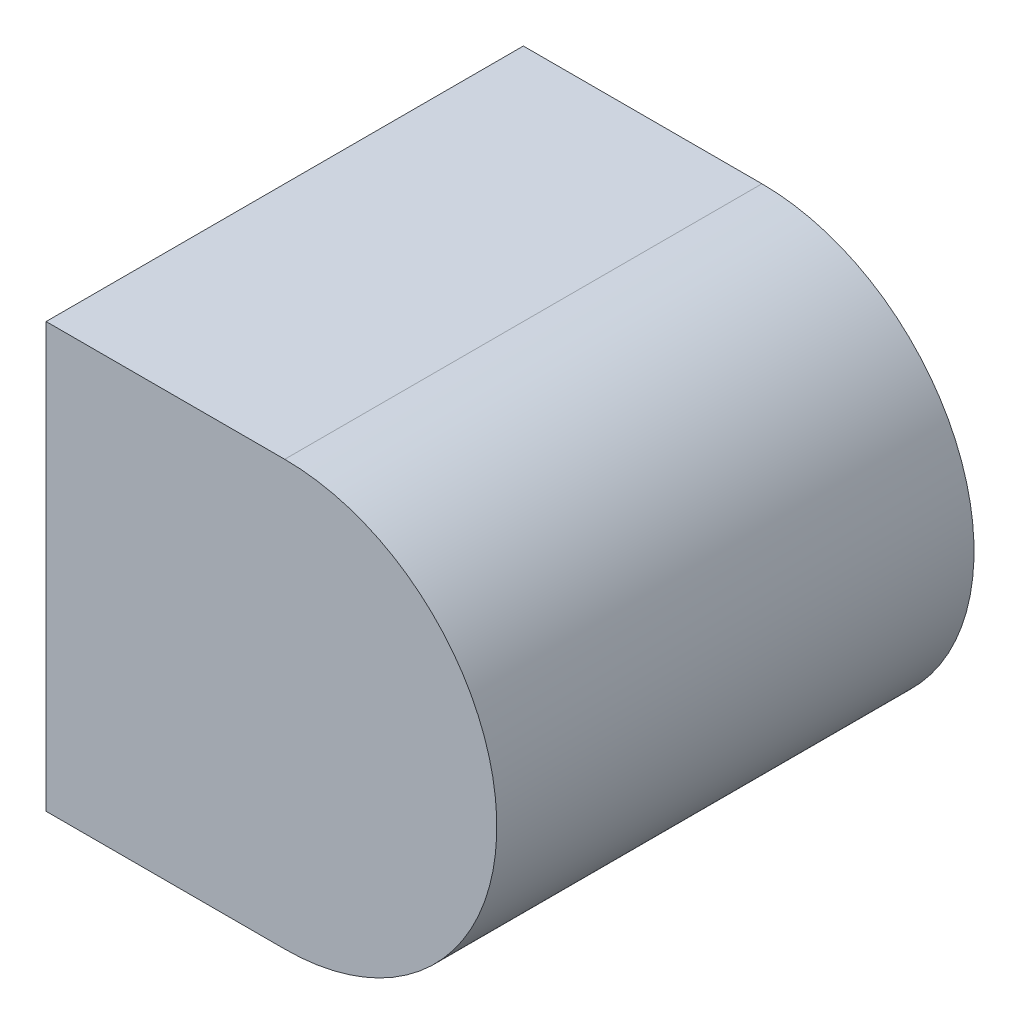
from build123d import *

# Parameters (mm, degrees)
BOSS_EXTRUDE1_DEPTH = 114.3
SKETCH2_R           = 1.27
BOSS_EXTRUDE2_DEPTH = 5.08


with BuildPart() as part:
    # Sketch1 → Boss-Extrude1 (new body)
    with BuildSketch(Plane.XY):
        with BuildLine():
            Line((0, -50.8), (-57.15, -50.8))
            Line((-57.15, -50.8), (-57.15, 50.8))
            Line((-57.15, 50.8), (0, 50.8))
            ThreePointArc((0, 50.8), (50.8, 0), (0, -50.8))
        make_face()
    extrude(amount=BOSS_EXTRUDE1_DEPTH)

    # Sketch2 → Boss-Extrude2 (add)
    with BuildSketch(Plane.XY.offset(114.3)):
        Circle(SKETCH2_R)
    extrude(amount=-BOSS_EXTRUDE2_DEPTH)


solid = part.part
